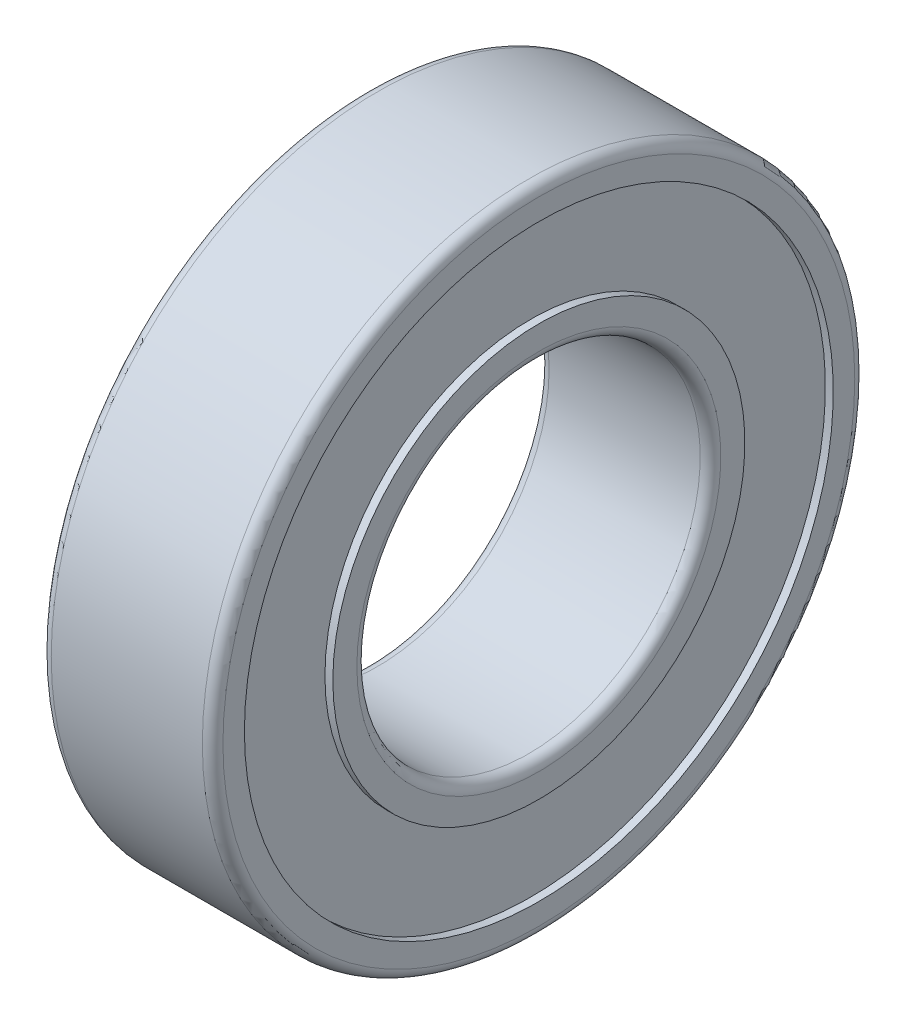
from build123d import *

# Parameters (mm, degrees)
FILLET1_R = 0.3
FILLET2_R = 0.3


with BuildPart() as part:
    # Sketch1 → Revolve1 (revolve)
    with BuildSketch(Plane.XY, mode=Mode.PRIVATE) as revolve1_sk:
        Polygon((0, 5), (5, 5), (5, 6), (4.77, 6), (4.77, 8.575), (5, 8.575), (5, 9.5), (0, 9.5), (0, 8.575), (0.23, 8.575), (0.23, 6), (0, 6), align=None)
    revolve(revolve1_sk.sketch.rotate(Axis((0, 0, 0), (1, 0, 0)), 90), axis=Axis((0, 0, 0), (1, 0, 0)))

    # Fillet1
    fillet1_edges = [part.edges().sort_by_distance(p)[0] for p in [
        (0, 0, -9.5),
        (5, 0, -9.5),
    ]]
    fillet(fillet1_edges, radius=FILLET1_R)

    # Fillet2
    fillet2_edges = [part.edges().sort_by_distance(p)[0] for p in [
        (5, 0, -5),
        (0, 0, -5),
    ]]
    fillet(fillet2_edges, radius=FILLET2_R)


solid = part.part
